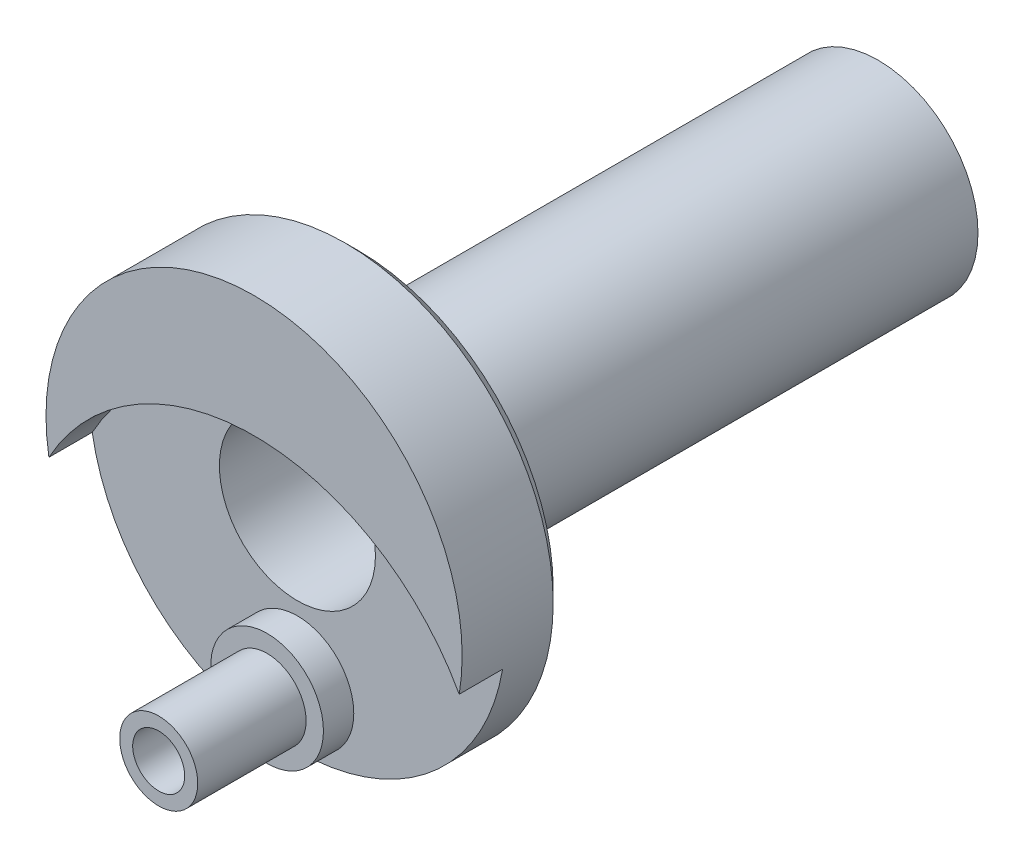
from build123d import *

# Parameters (mm, degrees)
ESQUISSE1_R                  = 12
BASE_EXTRUSION_DEPTH         = 6
ESQUISSE2_R                  = 5.75
BOSS_EXTRU_1_DEPTH           = 33
ESQUISSE3_R                  = 5.75
BOSS_EXTRU_2_DEPTH           = 6
BOSS_EXTRU_2_TAPER           = 10
BOSS_EXTRU_3_START           = -50.5
ESQUISSE4_R                  = 4
BOSS_EXTRU_3_DEPTH           = 5.5
ESQUISSE5_R                  = 13.5
ENL_V_MAT_EXTRU_1_DEPTH      = 2.5
ESQUISSE7_R                  = 3.25
BOSS_EXTRU_7_DEPTH           = 1.75
ESQUISSE8_R                  = 2.25
BOSS_EXTRU_8_DEPTH           = 6.25
PER_AGE1_D                   = 3
PER_AGE1_DEPTH               = 5
PER_AGE1_TIP                 = 0.901290929
ENL_V_MAT_EXTRU_2_DEPTH      = 43.532340728
ENL_V_MAT_EXTRU_2_DEPTH_BACK = 43.532340728
PER_AGE3_D                   = 9
PER_AGE3_DEPTH               = 22.5
PER_AGE3_TIP                 = 2.703872786
CHANFREIN1_SIZE              = 0.75
ESQUISSE22_W                 = 54.648205004
ESQUISSE22_H                 = 36.718532871
ENL_V_MAT_EXTRU_5_DEPTH      = 45.83581158


with BuildPart() as part:
    # Esquisse1 → Base-Extrusion (new body)
    with BuildSketch(Plane.XY):
        with Locations(Location((0, 0, 0), (0, 0, 189.594068227))):
            Circle(ESQUISSE1_R)
    extrude(amount=BASE_EXTRUSION_DEPTH)

    # Esquisse2 → Boss.-Extru.1 (add)
    with BuildSketch(Plane(origin=(0, 0, 0), x_dir=(-1, 0, 0), z_dir=(0, 0, -1))):
        with Locations(Location((0, 0, 0), (0, 0, 180))):
            Circle(ESQUISSE2_R)
    extrude(amount=BOSS_EXTRU_1_DEPTH)

    # Esquisse3 → Boss.-Extru.2 (add)
    with BuildSketch(Plane(origin=(0, 0, -33), x_dir=(-1, 0, 0), z_dir=(0, 0, -1))):
        with Locations(Location((0, 0, 0), (0, 0, 180))):
            Circle(ESQUISSE3_R)
    extrude(amount=BOSS_EXTRU_2_DEPTH, taper=BOSS_EXTRU_2_TAPER)

    # Esquisse4 → Boss.-Extru.3 (add)
    with BuildSketch(Plane(origin=(0, 0, -39), x_dir=(-1, 0, 0), z_dir=(0, 0, -1)).offset(BOSS_EXTRU_3_START)):
        Circle(ESQUISSE4_R)
    extrude(amount=BOSS_EXTRU_3_DEPTH)

    # Esquisse5 → Enlèv. mat.-Extru.1 (cut)
    with BuildSketch(Plane.XY.offset(6)):
        with Locations((0, -8.5)):
            Circle(ESQUISSE5_R)
    extrude(amount=-ENL_V_MAT_EXTRU_1_DEPTH, mode=Mode.SUBTRACT)

    # Esquisse7 → Boss.-Extru.7 (add)
    with BuildSketch(Plane.XY.offset(3.5)):
        with Locations((0, -8.5)):
            Circle(ESQUISSE7_R)
    extrude(amount=BOSS_EXTRU_7_DEPTH)

    # Esquisse8 → Boss.-Extru.8 (add)
    with BuildSketch(Plane.XY.offset(5.25)):
        with Locations((0, -8.5)):
            Circle(ESQUISSE8_R)
    extrude(amount=BOSS_EXTRU_8_DEPTH)

    # Perçage1
    with Locations(Plane.XY.offset(11.5)):
        with Locations((0, -8.5)):
            Hole(PER_AGE1_D / 2, depth=PER_AGE1_DEPTH)
            with Locations((0, 0, -(PER_AGE1_DEPTH + PER_AGE1_TIP / 2))):  # 118° drill point
                Cone(0, PER_AGE1_D / 2, PER_AGE1_TIP, mode=Mode.SUBTRACT)

    # Esquisse19 → Enlèv. mat.-Extru.2 (cut, two sides: drawn at the far end of the back side and taken through both)
    with BuildSketch(Plane(origin=(0, 0, 0), x_dir=(0.7071067811865488, 0.7071067811865462, 0), z_dir=(0.7071067811865462, -0.7071067811865488, 0)).offset(-ENL_V_MAT_EXTRU_2_DEPTH_BACK)):
        with BuildLine():
            Line((-5.75, -6), (-5, -6))
            ThreePointArc((-5, -6), (-3.939339828, -6.439339828), (-3.5, -7.5))
            Line((-3.5, -7.5), (-3.5, -16))
            ThreePointArc((-3.5, -16), (-3.939339828, -17.060660172), (-5, -17.5))
            Line((-5, -17.5), (-5.75, -17.5))
            Line((-5.75, -17.5), (-5.75, -6))
        make_face()
    extrude(amount=ENL_V_MAT_EXTRU_2_DEPTH + ENL_V_MAT_EXTRU_2_DEPTH_BACK, mode=Mode.SUBTRACT)

    # Perçage3
    with Locations(Plane.XY.offset(3.5)):
        with Locations((0, 0)):
            Hole(PER_AGE3_D / 2, depth=PER_AGE3_DEPTH)
            with Locations((0, 0, -(PER_AGE3_DEPTH + PER_AGE3_TIP / 2))):  # 118° drill point
                Cone(0, PER_AGE3_D / 2, PER_AGE3_TIP, mode=Mode.SUBTRACT)

    # Chanfrein1
    chanfrein1_edges = [part.edges().sort_by_distance(p)[0] for p in [
        (11.832159566, 2, 0),
    ]]
    chamfer(chanfrein1_edges, length=CHANFREIN1_SIZE)

    # Esquisse22 → Enlèv. mat.-Extru.5 (cut, through all)
    with BuildSketch(Plane.XY.offset(-30)):
        with Locations((3.376157781, -1.667455282)):
            Rectangle(ESQUISSE22_W, ESQUISSE22_H)
    extrude(amount=-ENL_V_MAT_EXTRU_5_DEPTH, mode=Mode.SUBTRACT)


solid = part.part
